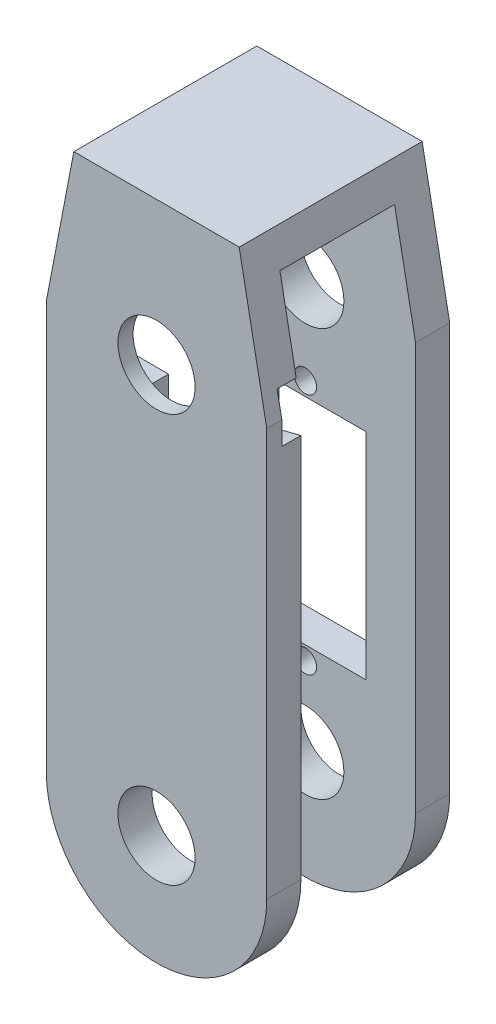
from build123d import *

# Parameters (mm, degrees)
SKETCH1_R           = 4.445
BOSS_EXTRUDE1_DEPTH = 3.937
BOSS_EXTRUDE3_START = -13.208
SKETCH1_5_R         = 4.445
SKETCH1_5_R_2       = 1.2954
SKETCH1_5_W         = 13.97
SKETCH1_5_H         = 24.765
BOSS_EXTRUDE3_DEPTH = 3.937
CUT_EXTRUDE4_DEPTH  = 2.1971
BOSS_EXTRUDE5_DEPTH = 16.4211


with BuildPart() as part:
    # Sketch1 (on Front Plane) → Boss-Extrude1 (new body)
    with BuildSketch(Plane.XY):
        with BuildLine():
            Line((-12.7, 0), (-9.525, 16.51))
            Line((-9.525, 16.51), (9.525, 16.51))
            Line((9.525, 16.51), (12.7, 0))
            Line((12.7, 0), (12.7, -46.99))
            ThreePointArc((12.7, -46.99), (0, -59.69), (-12.7, -46.99))
            Line((-12.7, -46.99), (-12.7, 0))
        make_face()
        Circle(SKETCH1_R, mode=Mode.SUBTRACT)
        with Locations((0, -46.99)):
            Circle(SKETCH1_R, mode=Mode.SUBTRACT)
    extrude(amount=BOSS_EXTRUDE1_DEPTH)

    # Sketch4 → Cut-Extrude4 (cut)
    with BuildSketch(Plane(origin=(0, 0, 0), x_dir=(-1, 0, 0), z_dir=(0, 0, -1))):
        with BuildLine():
            Line((-12.7, 0), (-12.7, -2.669886907))
            Line((-12.7, -2.669886907), (-6.878326735, -4.168384986))
            Line((-6.878326735, -4.168384986), (-2.54, -4.168384986))
            Line((-2.54, -4.168384986), (-2.54, -3.647797281))
            ThreePointArc((-2.54, -3.647797281), (-4.445, 0), (-2.54, 3.647797281))
            Line((-2.54, 3.647797281), (-2.54, 4.168384986))
            Line((-2.54, 4.168384986), (-6.878326735, 4.168384986))
            Line((-6.878326735, 4.168384986), (-12.15982138, 2.808928827))
            Line((-12.15982138, 2.808928827), (-12.7, 0))
        make_face()
        with BuildLine():
            Line((-1.543564577, -4.168384986), (-2.54, -4.168384986))
            Line((-2.54, -4.168384986), (-2.54, -8.89))
            Line((-2.54, -8.89), (2.54, -8.89))
            Line((2.54, -8.89), (2.54, -4.168384986))
            Line((2.54, -4.168384986), (1.543564577, -4.168384986))
            ThreePointArc((1.543564577, -4.168384986), (0, -4.445), (-1.543564577, -4.168384986))
        make_face()
        with BuildLine():
            Line((2.54, -3.647797281), (2.54, -4.168384986))
            Line((2.54, -4.168384986), (6.878326735, -4.168384986))
            Line((6.878326735, -4.168384986), (12.7, -2.669886907))
            Line((12.7, -2.669886907), (12.7, 0))
            Line((12.7, 0), (12.15982138, 2.808928827))
            Line((12.15982138, 2.808928827), (6.878326735, 4.168384986))
            Line((6.878326735, 4.168384986), (2.54, 4.168384986))
            Line((2.54, 4.168384986), (2.54, 3.647797281))
            ThreePointArc((2.54, 3.647797281), (3.940071383, 2.057635172), (4.445, 0))
            ThreePointArc((4.445, 0), (3.940071383, -2.057635172), (2.54, -3.647797281))
        make_face()
        with BuildLine():
            Line((-2.54, 8.89), (-2.54, 4.168384986))
            Line((-2.54, 4.168384986), (-1.543564577, 4.168384986))
            ThreePointArc((-1.543564577, 4.168384986), (0, 4.445), (1.543564577, 4.168384986))
            Line((1.543564577, 4.168384986), (2.54, 4.168384986))
            Line((2.54, 4.168384986), (2.54, 8.89))
            Line((2.54, 8.89), (-2.54, 8.89))
        make_face()
        with BuildLine():
            Line((2.54, 4.168384986), (1.543564577, 4.168384986))
            ThreePointArc((1.543564577, 4.168384986), (2.058307024, 3.939720446), (2.54, 3.647797281))
            Line((2.54, 3.647797281), (2.54, 4.168384986))
        make_face()
        with BuildLine():
            Line((-1.543564577, 4.168384986), (-2.54, 4.168384986))
            Line((-2.54, 4.168384986), (-2.54, 3.647797281))
            ThreePointArc((-2.54, 3.647797281), (-2.058307024, 3.939720446), (-1.543564577, 4.168384986))
        make_face()
        with BuildLine():
            ThreePointArc((2.54, -3.647797281), (2.058307024, -3.939720446), (1.543564577, -4.168384986))
            Line((1.543564577, -4.168384986), (2.54, -4.168384986))
            Line((2.54, -4.168384986), (2.54, -3.647797281))
        make_face()
        with BuildLine():
            Line((-2.54, -3.647797281), (-2.54, -4.168384986))
            Line((-2.54, -4.168384986), (-1.543564577, -4.168384986))
            ThreePointArc((-1.543564577, -4.168384986), (-2.058307024, -3.939720446), (-2.54, -3.647797281))
        make_face()
    extrude(amount=-CUT_EXTRUDE4_DEPTH, mode=Mode.SUBTRACT)



with BuildPart() as body_2:
    # Sketch1<5> → Boss-Extrude3 (new body)
    with BuildSketch(Plane.XY.offset(BOSS_EXTRUDE3_START)):
        with BuildLine():
            Line((-12.7, 0), (-9.525, 16.51))
            Line((-9.525, 16.51), (9.525, 16.51))
            Line((9.525, 16.51), (12.7, 0))
            Line((12.7, 0), (12.7, -46.99))
            ThreePointArc((12.7, -46.99), (0, -59.69), (-12.7, -46.99))
            Line((-12.7, -46.99), (-12.7, 0))
        make_face()
        Circle(SKETCH1_5_R, mode=Mode.SUBTRACT)
        with Locations((0, -10.16)):
            Circle(SKETCH1_5_R_2, mode=Mode.SUBTRACT)
        with Locations((0, -38.1)):
            Circle(SKETCH1_5_R_2, mode=Mode.SUBTRACT)
        with Locations((0, -46.99)):
            Circle(SKETCH1_5_R, mode=Mode.SUBTRACT)
        with Locations((0, -24.13)):
            Rectangle(SKETCH1_5_W, SKETCH1_5_H, mode=Mode.SUBTRACT)
    extrude(amount=-BOSS_EXTRUDE3_DEPTH)


with BuildPart() as part_1:
    add(part.part)

    add(body_2.part)  # Boss-Extrude5 merges body 2
    # Sketch5 → Boss-Extrude5 (add)
    with BuildSketch(Plane(origin=(0, 0, 0), x_dir=(-1, 0, 0), z_dir=(0, 0, -1))):
        Polygon((-9.525, 16.51), (9.525, 16.51), (10.282115385, 12.573), (-10.282115385, 12.573), align=None)
    extrude(amount=BOSS_EXTRUDE5_DEPTH)


solid = part_1.part
